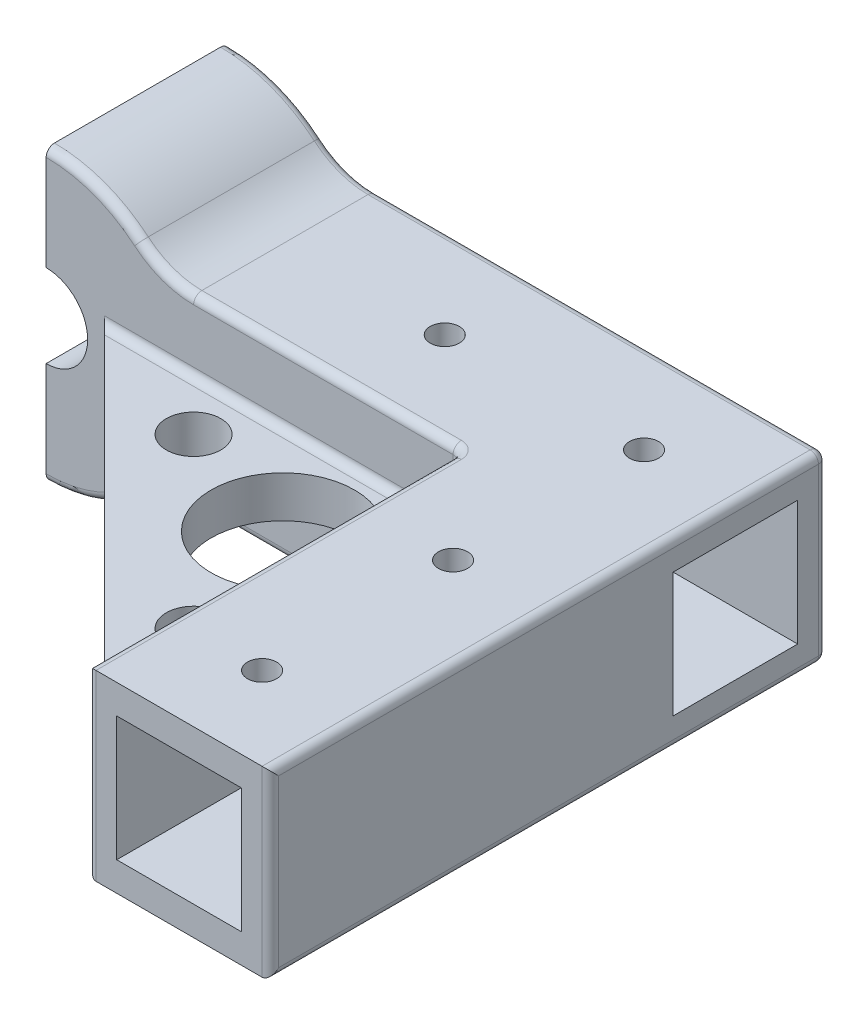
from build123d import *

# Parameters (mm, degrees)
BOSS_EXTRUDE1_DEPTH      = 22
SKETCH2_W                = 22
SKETCH2_H                = 22
BOSS_EXTRUDE2_DEPTH      = 45
SKETCH3_W                = 15
SKETCH3_H                = 15
CUT_EXTRUDE1_DEPTH       = 43
SKETCH4_W                = 15
SKETCH4_H                = 15
CUT_EXTRUDE2_DEPTH       = 45
BOSS_EXTRUDE3_DEPTH      = 2.5
BOSS_EXTRUDE3_DEPTH_BACK = 2.5
FILLET1_R                = 10
SKETCH5_R                = 1.75
CUT_EXTRUDE3_DEPTH       = 8
CUT_EXTRUDE5_REACH       = 98.649
SKETCH8_R                = 1.75
SKETCH9_W                = 4.563380282
SKETCH9_H                = 3.718309859
CUT_EXTRUDE6_DEPTH       = 1.5
CUT_EXTRUDE7_REACH       = 96.493
SKETCH10_R               = 8.636857144
SKETCH10_R_2             = 3.280749897
FILLET2_R                = 1
CUT_EXTRUDE8_DEPTH       = 3


with BuildPart() as part:
    # Sketch1 → Boss-Extrude1 (new body)
    with BuildSketch(Plane.XY):
        with BuildLine():
            Line((5.170578839, 4.123318258), (63.55992125, 4.123318258))
            Line((63.55992125, 4.123318258), (63.55992125, -17.876681742))
            Line((63.55992125, -17.876681742), (5.170578839, -17.876681742))
            ThreePointArc((5.170578839, -17.876681742), (-0.898527186, -22.66829344), (-8.44007875, -24.376681742))
            Line((-8.44007875, -24.376681742), (-8.44007875, -14.35565445))
            Line((-8.44007875, -14.35565445), (-8.44007875, -11.876681742))
            ThreePointArc((-8.44007875, -11.876681742), (-3.44007875, -6.876681742), (-8.44007875, -1.876681742))
            Line((-8.44007875, -1.876681742), (-8.44007875, 7.64434555))
            Line((-8.44007875, 7.64434555), (-8.44007875, 10.623318258))
            ThreePointArc((-8.44007875, 10.623318258), (-0.898527186, 8.914929955), (5.170578839, 4.123318258))
        make_face()
    extrude(amount=BOSS_EXTRUDE1_DEPTH)

    # Sketch2 → Boss-Extrude2 (add)
    with BuildSketch(Plane.XY.offset(22)):
        with Locations((52.55992125, -6.876681742)):
            Rectangle(SKETCH2_W, SKETCH2_H)
    extrude(amount=BOSS_EXTRUDE2_DEPTH)

    # Sketch3 → Cut-Extrude1 (cut)
    with BuildSketch(Plane.XY.offset(67)):
        with Locations((52.55992125, -6.876681742)):
            Rectangle(SKETCH3_W, SKETCH3_H)
    extrude(amount=-CUT_EXTRUDE1_DEPTH, mode=Mode.SUBTRACT)

    # Sketch4 → Cut-Extrude2 (cut)
    with BuildSketch(Plane(origin=(63.55992125, 0, 0), x_dir=(0, 0, -1), z_dir=(1, 0, 0))):
        with Locations((-11, -6.876681742)):
            Rectangle(SKETCH4_W, SKETCH4_H)
    extrude(amount=-CUT_EXTRUDE2_DEPTH, mode=Mode.SUBTRACT)

    # Sketch6 → Boss-Extrude3 (add, two sides: drawn at the far end of the back side and taken through both)
    with BuildSketch(Plane(origin=(0, -6.876681742, 0), x_dir=(1, 0, 0), z_dir=(0, 1, 0)).offset(-BOSS_EXTRUDE3_DEPTH_BACK)):
        Polygon((-1.44007875, -22), (41.55992125, -65), (41.55992125, -22), align=None)
    extrude(amount=BOSS_EXTRUDE3_DEPTH + BOSS_EXTRUDE3_DEPTH_BACK)

    # Fillet1
    fillet1_edges = [part.edges().sort_by_distance(p)[0] for p in [
        (5.170578839, -17.876681742, 11),
        (5.170578839, 4.123318258, 11),
    ]]
    fillet(fillet1_edges, radius=FILLET1_R)

    # Sketch5 → Cut-Extrude3 (cut)
    with BuildSketch(Plane.ZY.offset(8.44007875)):
        with Locations((11, 4.373318258)):
            Circle(SKETCH5_R)
        with Locations((11, -18.126681742)):
            Circle(SKETCH5_R)
    extrude(amount=-CUT_EXTRUDE3_DEPTH, mode=Mode.SUBTRACT)

    # Sketch8 → Cut-Extrude5 (cut, up to next)
    with BuildSketch(Plane.XZ.offset(17.876681742), mode=Mode.PRIVATE) as cut_extrude5_sk1:
        with Locations((28.55992125, 11)):
            Circle(SKETCH8_R)
    cut_extrude5_tool1 = extrude(cut_extrude5_sk1.sketch, amount=-CUT_EXTRUDE5_REACH, mode=Mode.PRIVATE) & part.part
    # Sketch8 → Cut-Extrude5 (cut, up to next)
    with BuildSketch(Plane.XZ.offset(17.876681742), mode=Mode.PRIVATE) as cut_extrude5_sk2:
        with Locations((52.55992125, 11)):
            Circle(SKETCH8_R)
    cut_extrude5_tool2 = extrude(cut_extrude5_sk2.sketch, amount=-CUT_EXTRUDE5_REACH, mode=Mode.PRIVATE) & part.part
    # Sketch8 → Cut-Extrude5 (cut, up to next)
    with BuildSketch(Plane.XZ.offset(17.876681742), mode=Mode.PRIVATE) as cut_extrude5_sk3:
        with Locations(Location((52.55992125, 34, 0), (0, 0, 270))):
            Circle(SKETCH8_R)
    cut_extrude5_tool3 = extrude(cut_extrude5_sk3.sketch, amount=-CUT_EXTRUDE5_REACH, mode=Mode.PRIVATE) & part.part
    # Sketch8 → Cut-Extrude5 (cut, up to next)
    with BuildSketch(Plane.XZ.offset(17.876681742), mode=Mode.PRIVATE) as cut_extrude5_sk4:
        with Locations(Location((52.55992125, 57, 0), (0, 0, 270))):
            Circle(SKETCH8_R)
    cut_extrude5_tool4 = extrude(cut_extrude5_sk4.sketch, amount=-CUT_EXTRUDE5_REACH, mode=Mode.PRIVATE) & part.part
    add(cut_extrude5_tool1.solids().sort_by_distance((28.559921, -17.876682, 11))[0], mode=Mode.SUBTRACT)
    add(cut_extrude5_tool1.solids().sort_by_distance((28.559921, -17.876682, 11))[1], mode=Mode.SUBTRACT)
    add(cut_extrude5_tool2.solids().sort_by_distance((52.559921, -17.876682, 11))[0], mode=Mode.SUBTRACT)
    add(cut_extrude5_tool2.solids().sort_by_distance((52.559921, -17.876682, 11))[1], mode=Mode.SUBTRACT)
    add(cut_extrude5_tool3.solids().sort_by_distance((52.559921, -17.876682, 34))[0], mode=Mode.SUBTRACT)
    add(cut_extrude5_tool3.solids().sort_by_distance((52.559921, -17.876682, 34))[1], mode=Mode.SUBTRACT)
    add(cut_extrude5_tool4.solids().sort_by_distance((52.559921, -17.876682, 57))[0], mode=Mode.SUBTRACT)
    add(cut_extrude5_tool4.solids().sort_by_distance((52.559921, -17.876682, 57))[1], mode=Mode.SUBTRACT)

    # Sketch9 → Cut-Extrude6 (cut)
    # profile 1 of 6: a face of its own
    with BuildSketch(Plane(origin=(0, 0, 0), x_dir=(-1, 0, 0), z_dir=(0, 0, -1))):
        Polygon((-53.489498715, -1.045695827), (-52.94020294, -1.853794418), (-52.94020294, -12.876681742), (-54.26854801, -12.876681742), (-54.79935787, -12.118759207), (-54.79935787, -8.989357799), (-59.048477588, -8.989357799), (-59.362738151, -9.472632447), (-59.362738151, -12.068583151), (-59.927878996, -12.876681742), (-60.691083222, -12.876681742), (-61.221893081, -12.124040897), (-61.221893081, -8.822984559), (-55.958688855, -1.045695827), align=None)
        Polygon((-55.248301532, -3.242878925), (-57.691083222, -6.7921747), (-54.79935787, -6.7921747), (-54.79935787, -3.242878925), align=None, mode=Mode.SUBTRACT)
    # profile 2 of 6: a face of its own
    with BuildSketch(Plane(origin=(0, 0, 0), x_dir=(-1, 0, 0), z_dir=(0, 0, -1))):
        Polygon((-50.950590264, -0.961188785), (-50.446188855, -0.876681742), (-49.88104801, -1.695343714), (-49.88104801, -10.679498644), (-45.317667729, -10.679498644), (-45.317667729, -9.506963432), (-44.784217024, -8.746400052), (-44.026294489, -8.746400052), (-43.458512799, -9.557139489), (-43.458512799, -12.876681742), (-51.230519841, -12.876681742), (-51.74020294, -12.116118362), (-51.74020294, -1.639885968), (-51.021893081, -0.998160616), align=None)
    # profile 3 of 6: a face of its own
    with BuildSketch(Plane(origin=(0, 0, 0), x_dir=(-1, 0, 0), z_dir=(0, 0, -1))):
        Polygon((-34.011153644, -2.289533855), (-34.549886039, -3.073864841), (-40.39935787, -3.073864841), (-40.39935787, -6.7921747), (-34.549886039, -6.7921747), (-34.011153644, -7.579146531), (-34.011153644, -8.205026813), (-34.549886039, -8.989357799), (-40.39935787, -8.989357799), (-40.39935787, -12.068583151), (-40.964498715, -12.876681742), (-41.72770294, -12.876681742), (-42.258512799, -12.116118362), (-42.258512799, -1.639885968), (-41.725062095, -0.876681742), (-34.549886039, -0.876681742), (-34.011153644, -1.663653573), align=None)
    # profile 4 of 6: a face of its own
    with BuildSketch(Plane(origin=(0, 0, 0), x_dir=(-1, 0, 0), z_dir=(0, 0, -1))):
        Polygon((-32.26713956, -0.876681742), (-25.036505757, -0.876681742), (-24.495132517, -1.690062024), (-24.495132517, -8.181259207), (-25.033864912, -8.989357799), (-27.085801532, -8.989357799), (-24.495132517, -12.876681742), (-26.64213956, -12.876681742), (-29.209040968, -8.989357799), (-30.917667729, -8.989357799), (-30.917667729, -12.068583151), (-31.482808574, -12.876681742), (-32.246012799, -12.876681742), (-32.776822658, -12.116118362), (-32.776822658, -1.639885968), align=None)
        with Locations((-28.635977588, -4.933019771)):
            Rectangle(SKETCH9_W, SKETCH9_H, mode=Mode.SUBTRACT)
    # profile 5 of 6: a face of its own
    with BuildSketch(Plane(origin=(0, 0, 0), x_dir=(-1, 0, 0), z_dir=(0, 0, -1))):
        Polygon((-23.295132517, -12.087069066), (-23.295132517, -10.848512728), (-23.295132517, -9.506963432), (-22.761681813, -8.746400052), (-22.003759278, -8.746400052), (-21.435977588, -9.557139489), (-21.435977588, -10.679498644), (-16.872597306, -10.679498644), (-16.872597306, -6.961188785), (-22.788090264, -6.961188785), (-23.295132517, -6.2296747), (-23.295132517, -5.500801461), (-22.788090264, -4.764005686), (-16.872597306, -4.764005686), (-16.872597306, -3.073864841), (-22.788090264, -3.073864841), (-23.295132517, -2.342350756), (-23.295132517, -1.613477517), (-22.780167729, -0.876681742), (-15.554815616, -0.876681742), (-15.013442377, -1.690062024), (-15.013442377, -12.876681742), (-15.784569137, -12.876681742), (-22.782808574, -12.876681742), (-23.028407165, -12.137245123), align=None)
    # profile 6 of 6: a face of its own
    with BuildSketch(Plane(origin=(0, 0, 0), x_dir=(-1, 0, 0), z_dir=(0, 0, -1))):
        Polygon((-13.303759278, -0.876681742), (-10.824005757, -0.876681742), (-5.531752236, -8.817702869), (-5.531752236, -12.876681742), (-6.302878996, -12.876681742), (-13.303759278, -12.876681742), (-13.813442377, -12.116118362), (-13.813442377, -1.639885968), align=None)
        Polygon((-11.539674771, -3.073864841), (-11.954287447, -3.073864841), (-11.954287447, -10.679498644), (-7.390907165, -10.679498644), (-7.390907165, -9.575625404), align=None, mode=Mode.SUBTRACT)
    extrude(amount=-CUT_EXTRUDE6_DEPTH, mode=Mode.SUBTRACT)

    # Sketch10 → Cut-Extrude7 (cut, up to next)
    with BuildSketch(Plane.XZ.offset(9.376681742), mode=Mode.PRIVATE) as cut_extrude7_sk1:
        with Locations(Location((30.80992125, 32.75, 0), (0, 0, 270))):
            Circle(SKETCH10_R)
    cut_extrude7_tool1 = extrude(cut_extrude7_sk1.sketch, amount=-CUT_EXTRUDE7_REACH, mode=Mode.PRIVATE) & part.part
    # Sketch10 → Cut-Extrude7 (cut, up to next)
    with BuildSketch(Plane.XZ.offset(9.376681742), mode=Mode.PRIVATE) as cut_extrude7_sk2:
        with Locations(Location((35.55992125, 48.25, 0), (0, 0, 270))):
            Circle(SKETCH10_R_2)
    cut_extrude7_tool2 = extrude(cut_extrude7_sk2.sketch, amount=-CUT_EXTRUDE7_REACH, mode=Mode.PRIVATE) & part.part
    # Sketch10 → Cut-Extrude7 (cut, up to next)
    with BuildSketch(Plane.XZ.offset(9.376681742), mode=Mode.PRIVATE) as cut_extrude7_sk3:
        with Locations(Location((15.30992125, 28, 0), (0, 0, 270))):
            Circle(SKETCH10_R_2)
    cut_extrude7_tool3 = extrude(cut_extrude7_sk3.sketch, amount=-CUT_EXTRUDE7_REACH, mode=Mode.PRIVATE) & part.part
    add(cut_extrude7_tool1.solids().sort_by_distance((30.809921, -9.376682, 32.75))[0], mode=Mode.SUBTRACT)
    add(cut_extrude7_tool2.solids().sort_by_distance((35.559921, -9.376682, 48.25))[0], mode=Mode.SUBTRACT)
    add(cut_extrude7_tool3.solids().sort_by_distance((15.309921, -9.376682, 28))[0], mode=Mode.SUBTRACT)

    # Fillet2
    fillet2_edges = [part.edges().sort_by_distance(p)[0] for p in [
        (63.55992125, -6.876681742, 0),
        (-2.424001804, -23.310087299, 0),
        (63.55992125, 4.123318258, 33.5),
        (63.55992125, -17.876681742, 33.5),
        (-2.424001804, -23.310087299, 22),
        (25.437561702, 4.123318258, 22),
        (41.55992125, -0.126681742, 22),
        (41.55992125, 4.123318258, 44.5),
        (41.55992125, -17.876681742, 44.5),
        (63.55992125, -6.876681742, 67),
        (41.55992125, -6.876681742, 67),
        (41.55992125, -13.626681742, 22),
        (20.05992125, -9.376681742, 22),
        (41.55992125, -9.376681742, 43.5),
        (20.05992125, -4.376681742, 22),
        (41.55992125, -4.376681742, 43.5),
        (36.437561702, -17.876681742, 0),
        (25.437561702, -17.876681742, 22),
        (-2.424001804, 9.556723814, 0),
        (-2.424001804, 9.556723814, 22),
        (5.8774439, -18.486164282, 0),
        (5.8774439, -18.486164282, 22),
        (5.8774439, 4.732800797, 0),
        (5.8774439, 4.732800797, 22),
        (36.437561702, 4.123318258, 0),
    ]]
    fillet(fillet2_edges, radius=FILLET2_R)

    # Sketch11 → Cut-Extrude8 (cut)
    with BuildSketch(Plane.ZY.offset(8.44007875)):
        Polygon((12.58771324, 7.123318258), (9.41228676, 7.123318258), (7.824573519, 4.373318258), (9.41228676, 1.623318258), (12.58771324, 1.623318258), (14.175426481, 4.373318258), align=None)
        Polygon((14.175426481, -18.126681742), (12.58771324, -15.376681742), (9.41228676, -15.376681742), (7.824573519, -18.126681742), (9.41228676, -20.876681742), (12.58771324, -20.876681742), align=None)
    extrude(amount=-CUT_EXTRUDE8_DEPTH, mode=Mode.SUBTRACT)


solid = part.part
